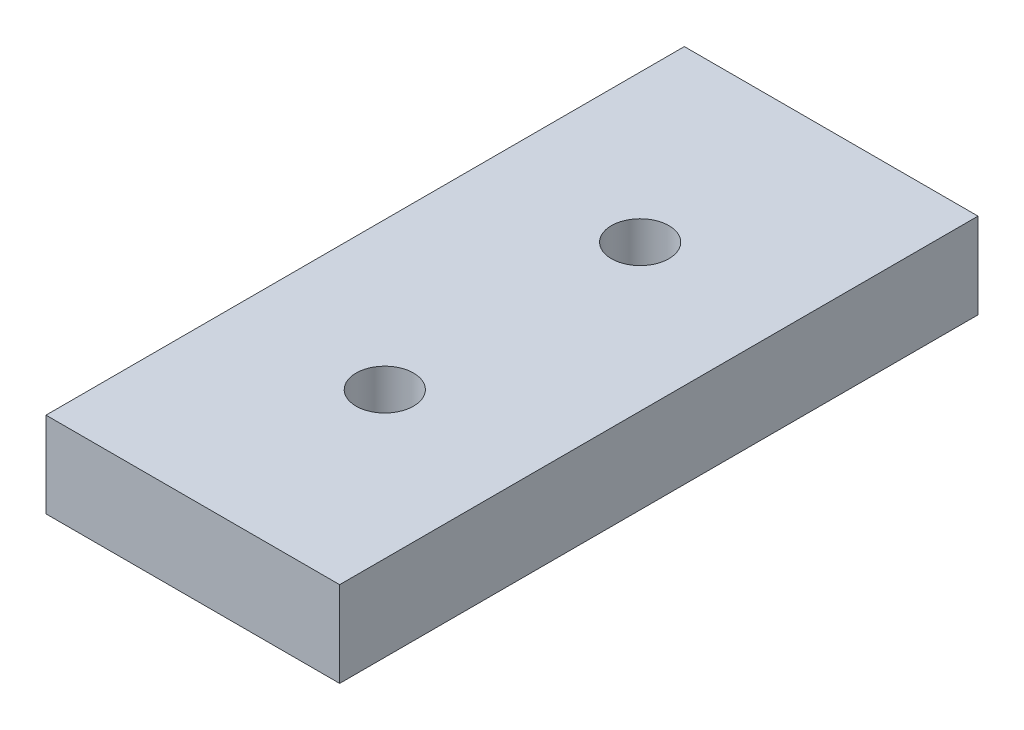
from build123d import *

# Parameters (mm, degrees)
SKETCH1_W           = 23
SKETCH1_H           = 50
SKETCH1_R           = 2.25
BOSS_EXTRUDE1_DEPTH = 6.7


with BuildPart() as part:
    # Sketch1 → Boss-Extrude1 (new body)
    with BuildSketch(Plane(origin=(0, 0, 0), x_dir=(1, 0, 0), z_dir=(0, 1, 0))):
        with Locations((11.5, 25)):
            Rectangle(SKETCH1_W, SKETCH1_H)
        with Locations(Location((11.537386981, 35, 0), (0, 0, 270))):
            Circle(SKETCH1_R, mode=Mode.SUBTRACT)
        with Locations(Location((11.537386981, 15, 0), (0, 0, 270))):
            Circle(SKETCH1_R, mode=Mode.SUBTRACT)
    extrude(amount=BOSS_EXTRUDE1_DEPTH)


solid = part.part
